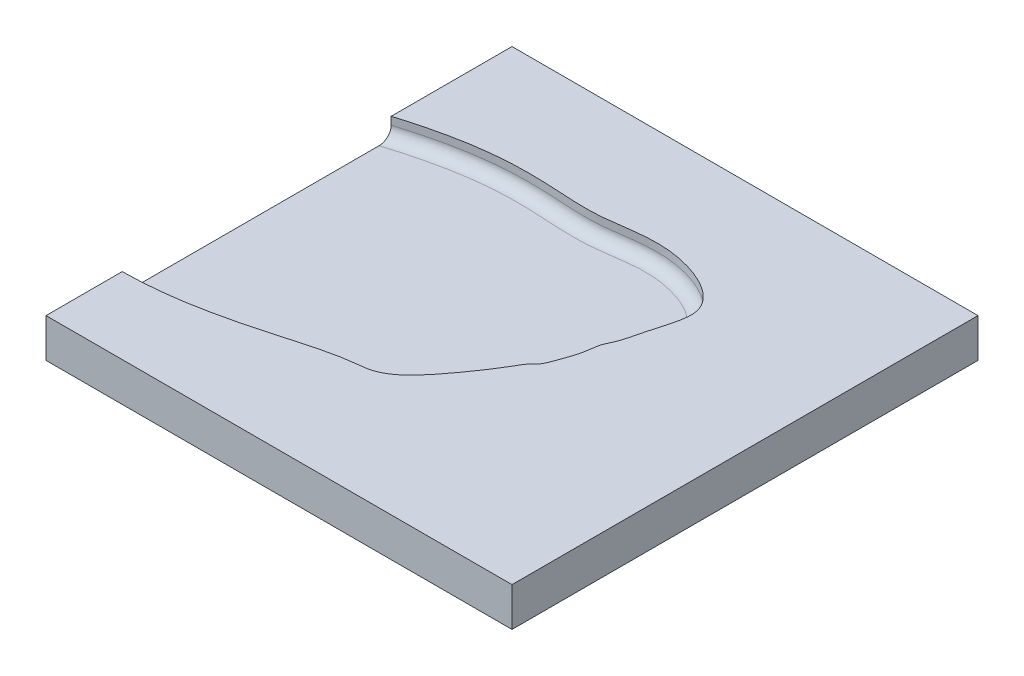
from build123d import *

# Parameters (mm, degrees)
SCHIZZO2_W                   = 120
SCHIZZO2_H                   = 120
ESTRUSIONE_ESTRUSIONE2_DEPTH = 10
FORO_PER_VITE_M2_5_2_D       = 3.1
FORO_PER_VITE_M2_5_2_DEPTH   = 4
FORO_PER_VITE_M2_5_2_TIP     = 0.931333959
TAGLIO_ESTRUSIONE1_DEPTH     = 5
RACCORDO1_R                  = 3


with BuildPart() as part:
    # Schizzo2 → Estrusione-Estrusione2 (new body)
    with BuildSketch(Plane(origin=(0, 0, 0), x_dir=(1, 0, 0), z_dir=(0, 1, 0))):
        with Locations((57.336140445, -89.689917766)):
            Rectangle(SCHIZZO2_W, SCHIZZO2_H)
    extrude(amount=ESTRUSIONE_ESTRUSIONE2_DEPTH)

    # Foro per Vite M2.5-2
    with Locations(Plane(origin=(57.336140445, 0, 69.689917766), x_dir=(0, 0, -1), z_dir=(0, -1, 0))):
        with Locations((0, 0), (-40, 0)):
            Hole(FORO_PER_VITE_M2_5_2_D / 2, depth=FORO_PER_VITE_M2_5_2_DEPTH)
            with Locations((0, 0, -(FORO_PER_VITE_M2_5_2_DEPTH + FORO_PER_VITE_M2_5_2_TIP / 2))):  # 118° drill point
                Cone(0, FORO_PER_VITE_M2_5_2_D / 2, FORO_PER_VITE_M2_5_2_TIP, mode=Mode.SUBTRACT)

    # Schizzo10 → Taglio-Estrusione1 (cut)
    with BuildSketch(Plane(origin=(0, 10, 0), x_dir=(1, 0, 0), z_dir=(0, 1, 0))):
        with BuildLine():
            Line((-2.663859555, -60.802596799), (-2.663859555, -130.063136574))
            add(Edge.make_bspline(
                [(-2.663859555, -60.802596799), (24.120458808, -52.569954294), (39.186624842, -58.989375392), (63.038306723, -52.725855782), (83.808423835, -61.253409566), (78.352880408, -73.941492055), (76.969845115, -81.425430824), (75.06672503, -84.958843946), (74.867241782, -88.836485772), (73.337118961, -92.829619198), (72.180976636, -96.649123539), (69.344468912, -99.046734159), (69.335451288, -100.716029068), (55.064188681, -120.559334241), (41.363004275, -119.412240667), (18.774542286, -129.920141134), (-2.663859555, -130.063136574)],
                knots=[0, 0, 0, 0, 0.23082752, 0.329751683, 0.448049595, 0.523336191, 0.556692415, 0.56273154, 0.583727435, 0.6089427, 0.641848116, 0.652121656, 0.711678095, 0.742832598, 0.807026375, 1, 1, 1, 1], degree=3))
        make_face()
    extrude(amount=-TAGLIO_ESTRUSIONE1_DEPTH, mode=Mode.SUBTRACT)

    # Raccordo1
    raccordo1_edges = [part.edges().sort_by_distance(p)[0] for p in [
        (76.957515661, 5, 80.743306594),
    ]]
    fillet(raccordo1_edges, radius=RACCORDO1_R)


solid = part.part
